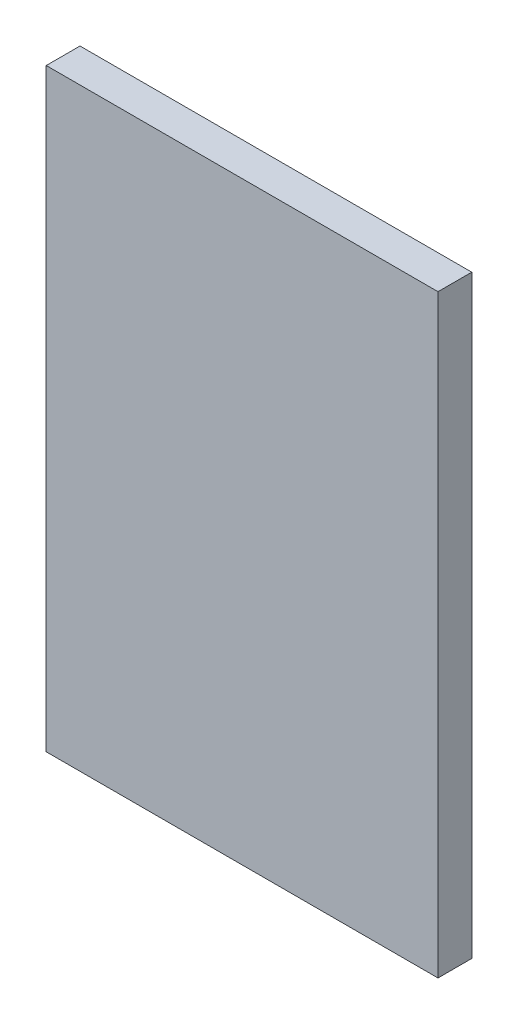
from build123d import *

# Parameters (mm, degrees)
SKETCH1_W           = 88
SKETCH1_H           = 58
BOSS_EXTRUDE1_DEPTH = 5


with BuildPart() as part:
    # Sketch1 → Boss-Extrude1 (new body)
    with BuildSketch(Plane(origin=(0, 0, 0), x_dir=(0, 1, 0), z_dir=(0, 0, 1))):
        with Locations((44, 29)):
            Rectangle(SKETCH1_W, SKETCH1_H)
    extrude(amount=BOSS_EXTRUDE1_DEPTH)


solid = part.part
